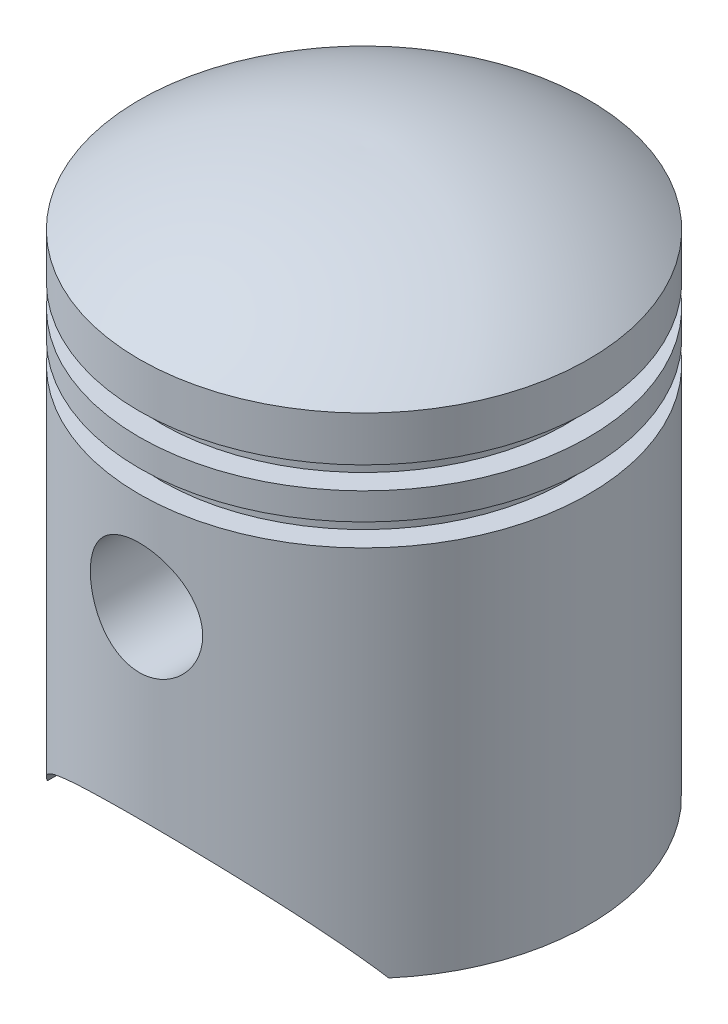
from build123d import *

# Parameters (mm, degrees)
CUT_EXTRUDE1_DEPTH       = 35
SKETCH4_R                = 6.25
CUT_EXTRUDE2_DEPTH       = 40
BOSS_EXTRUDE1_REACH      = 78.823
BOSS_EXTRUDE1_END_RADIUS = 23
SKETCH6_R                = 7.25
SKETCH6_R_2              = 6.25


with BuildPart() as part:
    # Sketch1 → Revolve1 (revolve)
    with BuildSketch(Plane.XY, mode=Mode.PRIVATE) as revolve1_sk:
        with BuildLine():
            Line((0, 62.5), (0, 60.49936285))
            ThreePointArc((0, 60.49936285), (12.069492637, 58.859165445), (23, 53.484511145))
            Line((23, 53.484511145), (23, 51.5))
            Line((23, 51.5), (20.5, 51.5))
            Line((20.5, 51.5), (20.5, 45.5))
            Line((20.5, 45.5), (20.5, 39.5))
            Line((20.5, 39.5), (23, 39.5))
            Line((23, 39.5), (23, 0))
            Line((23, 0), (25, 0))
            Line((25, 0), (25, 41.5))
            Line((25, 41.5), (22.5, 41.5))
            Line((22.5, 41.5), (22.5, 44))
            Line((22.5, 44), (25, 44))
            Line((25, 44), (25, 47))
            Line((25, 47), (22.5, 47))
            Line((22.5, 47), (22.5, 49.5))
            Line((22.5, 49.5), (25, 49.5))
            Line((25, 49.5), (25, 54.5))
            ThreePointArc((25, 54.5), (13.174901691, 60.609067785), (0, 62.5))
        make_face()
    revolve(revolve1_sk.sketch.rotate(Axis((0, 62.5, 0), (0, -1, 0)), 90), axis=Axis((0, 62.5, 0), (0, -1, 0)))

    # Sketch2 → Cut-Extrude1 (cut, symmetric)
    with BuildSketch(Plane.XY):
        with BuildLine():
            Line((19, 0), (-19, 0))
            ThreePointArc((-19, 0), (0, 10.195912684), (19, 0))
        make_face()
    extrude(amount=CUT_EXTRUDE1_DEPTH, both=True, mode=Mode.SUBTRACT)

    # Sketch4 → Cut-Extrude2 (cut, symmetric)
    with BuildSketch(Plane.XY):
        with Locations((0, 30.562924267)):
            Circle(SKETCH4_R)
    extrude(amount=CUT_EXTRUDE2_DEPTH, both=True, mode=Mode.SUBTRACT)

    # Boss-Extrude1: up to this cylinder (the profile starts inside it)
    boss_extrude1_end = Plane(origin=(0, 23.517985, 0), z_dir=(0, 1, 0)) * Cylinder(BOSS_EXTRUDE1_END_RADIUS, 204.646, mode=Mode.PRIVATE)
    # Sketch6 → Boss-Extrude1 (add, up to the surface)
    with BuildSketch(Plane.XY.offset(12), mode=Mode.PRIVATE) as boss_extrude1_sk1:
        with Locations(Location((0, 30.562924267, 0), (0, 0, 90))):
            Circle(SKETCH6_R)
        with Locations((0, 30.562924267)):
            Circle(SKETCH6_R_2, mode=Mode.SUBTRACT)
    boss_extrude1_tool1 = extrude(boss_extrude1_sk1.sketch, amount=BOSS_EXTRUDE1_REACH, mode=Mode.PRIVATE) & boss_extrude1_end
    boss_extrude1 = boss_extrude1_tool1.solids().sort_by_distance((0, 23.517985, 12))[0]
    add(boss_extrude1)

    # Mirror2: Boss-Extrude1 across plane
    add(boss_extrude1.mirror(Plane.XY))


solid = part.part
